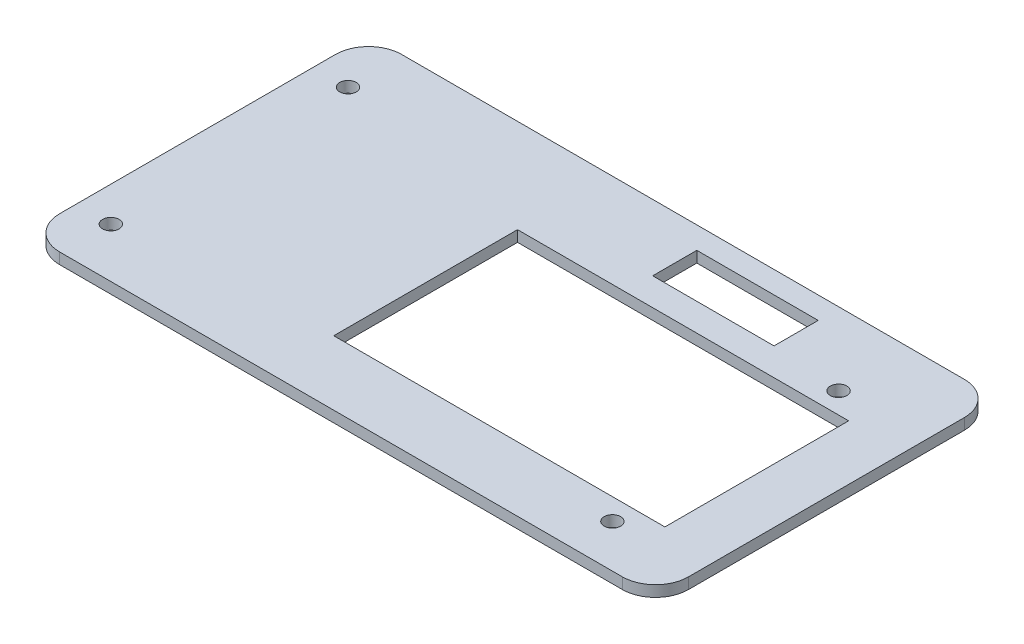
from build123d import *

# Parameters (mm, degrees)
SKETCH_1_W          = 60.026557182
SKETCH_1_H          = 33.312327563
EXTRUDE_1_DEPTH     = 2
SKETCH_3_R          = 1.5
SKETCH_3_W          = 22
SKETCH_3_H          = 8
CUT_EXTRUDE_1_DEPTH = 10
FILLET_1_R          = 6


with BuildPart() as part:
    # Эскиз1 → Бобышка-Вытянуть1 (new body)
    with BuildSketch(Plane(origin=(0, 0, 0), x_dir=(1, 0, 0), z_dir=(0, 1, 0))):
        Polygon((-82.5, -31), (-82.5, -21), (-82.5, 31), (-31.5, 31), (31.5, 31), (31.5, -31), align=None)
        with Locations((-8.486721409, -2.656163782)):
            Rectangle(SKETCH_1_W, SKETCH_1_H, mode=Mode.SUBTRACT)
    extrude(amount=EXTRUDE_1_DEPTH)

    # Эскиз3 → Вырез-Вытянуть1 (cut)
    with BuildSketch(Plane.XZ.offset(-2)):
        with Locations(Location((15.9, 23.2, 0), (0, 0, 270))):
            Circle(SKETCH_3_R)
        with Locations(Location((15.9, -17.8, 0), (0, 0, 270))):
            Circle(SKETCH_3_R)
        with Locations(Location((-76.22, 22, 0), (0, 0, 270))):
            Circle(SKETCH_3_R)
        with Locations(Location((-76.22, -21, 0), (0, 0, 270))):
            Circle(SKETCH_3_R)
        with Locations((-8, -23)):
            Rectangle(SKETCH_3_W, SKETCH_3_H)
    extrude(amount=CUT_EXTRUDE_1_DEPTH, mode=Mode.SUBTRACT)

    # Скругление1
    fillet_1_edges = [part.edges().sort_by_distance(p)[0] for p in [
        (-82.5, 1, 31),
        (-82.5, 1, -31),
        (31.5, 1, -31),
        (31.5, 1, 31),
    ]]
    fillet(fillet_1_edges, radius=FILLET_1_R)


solid = part.part
